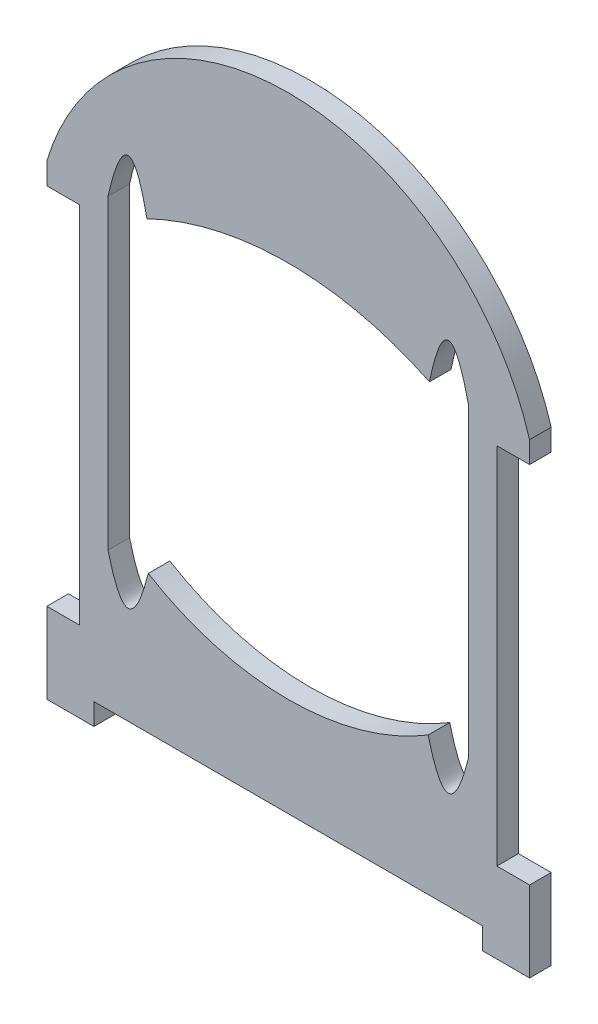
from build123d import *

# Parameters (mm, degrees)
BOSS_EXTRUDE1_DEPTH = 3
SKETCH4_W           = 54
SKETCH4_H           = 3
CUT_EXTRUDE1_DEPTH  = 10


with BuildPart() as part:
    # Sketch2 → Boss-Extrude1 (new body)
    with BuildSketch(Plane.XY):
        with BuildLine():
            Line((-33.55, 0), (33.55, 0))
            Line((33.55, 0), (33.55, 11.2))
            Line((33.55, 11.2), (29, 11.2))
            Line((29, 11.2), (29, 61.8))
            Line((29, 61.8), (33.55, 61.8))
            Line((33.55, 61.8), (33.55, 64.8))
            ThreePointArc((33.55, 64.8), (0, 89.8), (-33.55, 64.8))
            Line((-33.55, 64.8), (-33.55, 61.8))
            Line((-33.55, 61.8), (-29, 61.8))
            Line((-29, 61.8), (-29, 11.2))
            Line((-29, 11.2), (-33.55, 11.2))
            Line((-33.55, 11.2), (-33.55, 0))
        make_face()
        with BuildLine():
            Line((-25.05, 64.8), (-25.05, 22.2))
            add(Edge.make_bspline(
                [(-25.05, 22.2), (-22.25, 11), (-19.45, 22.2)],
                knots=[0, 0, 0, 1, 1, 1], degree=2))
            ThreePointArc((-19.45, 22.2), (0, 16.75), (19.45, 22.2))
            add(Edge.make_bspline(
                [(19.45, 22.2), (22.25, 11), (25.05, 22.2)],
                knots=[0, 0, 0, 1, 1, 1], degree=2))
            Line((25.05, 22.2), (25.05, 64.8))
            add(Edge.make_bspline(
                [(19.632941567, 64.8), (22.187059742, 77.400349627), (25.05, 64.8)],
                knots=[0, 0, 0, 1, 1, 1], degree=2))
            ThreePointArc((19.632941567, 64.8), (0, 69.3), (-19.632941567, 64.8))
            add(Edge.make_bspline(
                [(-25.05, 64.8), (-22.187059742, 77.400349627), (-19.632941567, 64.8)],
                knots=[0, 0, 0, 1, 1, 1], degree=2))
        make_face(mode=Mode.SUBTRACT)
    extrude(amount=BOSS_EXTRUDE1_DEPTH)

    # Sketch4 → Cut-Extrude1 (cut)
    with BuildSketch(Plane.XY.offset(3)):
        with Locations((0, 1.5)):
            Rectangle(SKETCH4_W, SKETCH4_H)
    extrude(amount=-CUT_EXTRUDE1_DEPTH, mode=Mode.SUBTRACT)


solid = part.part
